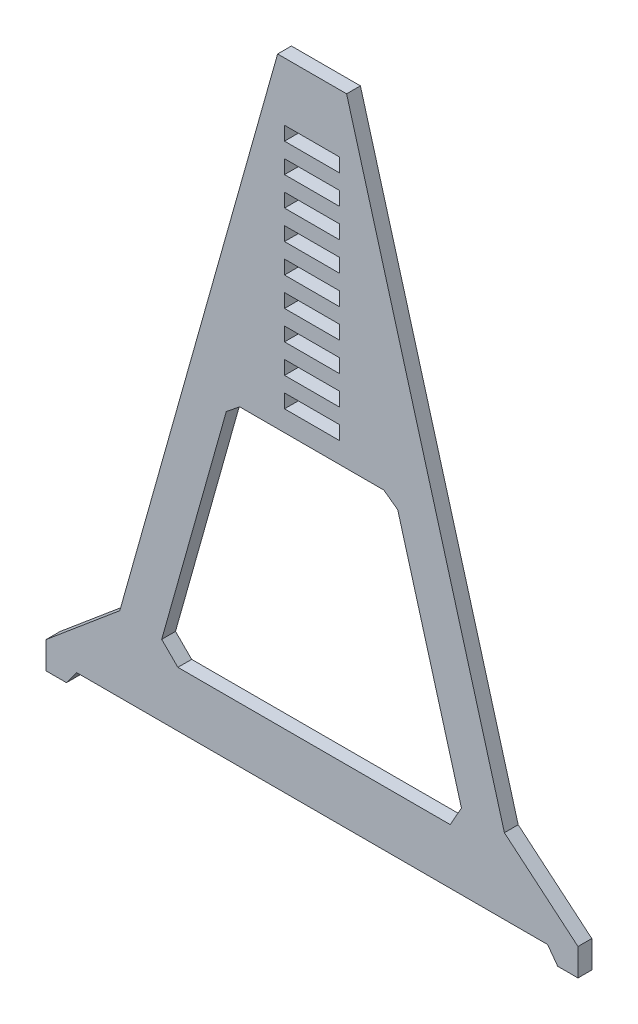
from build123d import *
from OCP.BRepFilletAPI import BRepFilletAPI_MakeChamfer

# Parameters (mm, degrees)
BOSS_EXTRUDE1_DEPTH = 25.4
CHAMFER1_SIZE       = 38.1
CHAMFER1_SIZE2      = 30.889863159
CHAMFER2_SIZE       = 20.32
CHAMFER2_SIZE2      = 19.275364183
SKETCH2_W           = 101.6
SKETCH2_H           = 25.4
CUT_EXTRUDE2_DEPTH  = 775.10421823
LPATTERN1_COUNT     = 2
LPATTERN1_PITCH     = 106.68


with BuildPart() as part:
    # Sketch1 → Boss-Extrude1 (new body)
    with BuildSketch(Plane.XY):
        Polygon((0, 597.4769356), (0, 0), (152.4, 0), (285.215433829, -472.186), (0, -472.186), (0, -573.786), (415.976251613, -573.786), (433.57458701, -573.786), (452.189239648, -599.186), (469.838640091, -599.186), (489.457166752, -599.186), (489.457166752, -548.960321271), (361.710639116, -441.768257047), (353.995711594, -435.294664209), (63.5, 597.4769356), align=None)
    boss_extrude1 = extrude(amount=BOSS_EXTRUDE1_DEPTH)

    # Mirror1: Boss-Extrude1 across plane
    add(boss_extrude1.mirror(Plane(origin=(0, 0, 25.4), x_dir=(0, 0, 1), z_dir=(1, 0, 0))))

    # Chamfer1: one chamfer whose edges measure the first distance from different faces: ONE call of the kernel's chamfer builder (chamfer() names one face for all edges)
    chamfer1_edges_1 = [part.edges().sort_by_distance(p)[0] for p in [
        (285.215433829, -472.186, 12.7),
    ]]
    chamfer1_side_1 = [part.faces().sort_by_distance(p)[0] for p in [
        (218.807716914, -236.093, 12.7),
    ]]
    chamfer1_edges_2 = [part.edges().sort_by_distance(p)[0] for p in [
        (-285.215433829, -472.186, 12.7),
    ]]
    chamfer1_side_2 = [part.faces().sort_by_distance(p)[0] for p in [
        (0, -472.186, 12.7),
    ]]
    chamfer1 = BRepFilletAPI_MakeChamfer(part.part.solid().wrapped)
    for e in chamfer1_edges_1:
        chamfer1.Add(CHAMFER1_SIZE, CHAMFER1_SIZE2, e.wrapped, chamfer1_side_1[0].wrapped)  # the first distance lies on this face
    for e in chamfer1_edges_2:
        chamfer1.Add(CHAMFER1_SIZE, CHAMFER1_SIZE2, e.wrapped, chamfer1_side_2[0].wrapped)  # the first distance lies on this face
    add(Compound.cast(chamfer1.Shape()), mode=Mode.REPLACE)

    # Chamfer2: one chamfer whose edges measure the first distance from different faces: ONE call of the kernel's chamfer builder (chamfer() names one face for all edges)
    chamfer2_edges_1 = [part.edges().sort_by_distance(p)[0] for p in [
        (152.4, 0, 12.7),
    ]]
    chamfer2_side_1 = [part.faces().sort_by_distance(p)[0] for p in [
        (0, 0, 12.7),
    ]]
    chamfer2_edges_2 = [part.edges().sort_by_distance(p)[0] for p in [
        (-152.4, 0, 12.7),
    ]]
    chamfer2_side_2 = [part.faces().sort_by_distance(p)[0] for p in [
        (-214.625687132, -221.225029782, 12.7),
    ]]
    chamfer2 = BRepFilletAPI_MakeChamfer(part.part.solid().wrapped)
    for e in chamfer2_edges_1:
        chamfer2.Add(CHAMFER2_SIZE, CHAMFER2_SIZE2, e.wrapped, chamfer2_side_1[0].wrapped)  # the first distance lies on this face
    for e in chamfer2_edges_2:
        chamfer2.Add(CHAMFER2_SIZE, CHAMFER2_SIZE2, e.wrapped, chamfer2_side_2[0].wrapped)  # the first distance lies on this face
    add(Compound.cast(chamfer2.Shape()), mode=Mode.REPLACE)

    # Sketch2 → Cut-Extrude2 (cut, through all)
    with BuildSketch(Plane.XY.offset(25.4)):
        with Locations((0, 50.8)):
            Rectangle(SKETCH2_W, SKETCH2_H)
        with Locations((0, 104.14)):
            Rectangle(SKETCH2_W, SKETCH2_H)
        with Locations((0, 157.48)):
            Rectangle(SKETCH2_W, SKETCH2_H)
        with Locations((0, 210.82)):
            Rectangle(SKETCH2_W, SKETCH2_H)
        with Locations((0, 264.16)):
            Rectangle(SKETCH2_W, SKETCH2_H)
        with Locations((0, 317.5)):
            Rectangle(SKETCH2_W, SKETCH2_H)
        with Locations((0, 370.84)):
            Rectangle(SKETCH2_W, SKETCH2_H)
    cut_extrude2 = extrude(amount=-CUT_EXTRUDE2_DEPTH, mode=Mode.SUBTRACT)

    # LPattern1: Cut-Extrude2 ×2
    with Locations(*[(0, i * LPATTERN1_PITCH, 0) for i in range(1, LPATTERN1_COUNT)]):
        add(cut_extrude2, mode=Mode.SUBTRACT)


solid = part.part
